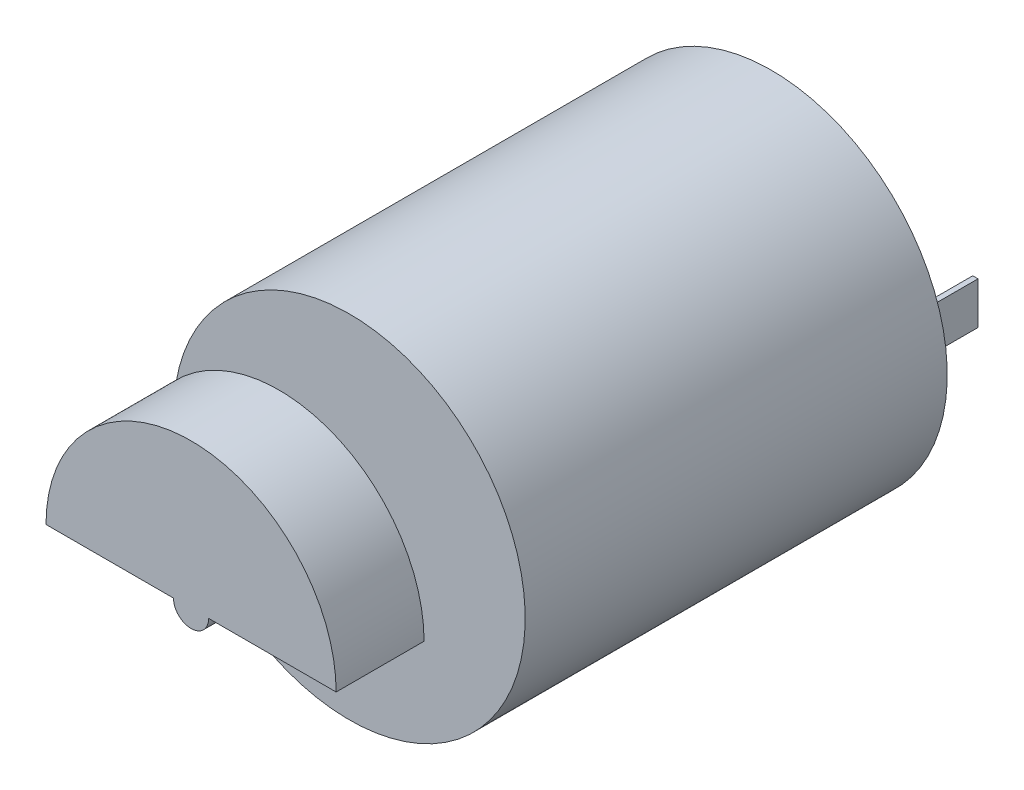
from build123d import *

# Parameters (mm, degrees)
SKETCH1_R           = 12.7
BOSS_EXTRUDE1_DEPTH = 15.24
SKETCH2_R           = 3.048
BOSS_EXTRUDE2_DEPTH = 1.27
SKETCH3_R           = 1.27
BOSS_EXTRUDE3_DEPTH = 10.16
BOSS_EXTRUDE4_DEPTH = 6.35
SKETCH5_R           = 4.191
BOSS_EXTRUDE5_DEPTH = 2.032
SKETCH6_W           = 0.381
SKETCH6_H           = 3.048
BOSS_EXTRUDE6_DEPTH = 5.588


with BuildPart() as part:
    # Sketch1 → Boss-Extrude1 (new, symmetric)
    with BuildSketch(Plane.XY):
        with Locations(Location((0, 0, 0), (0, 0, 180))):
            Circle(SKETCH1_R)
    extrude(amount=BOSS_EXTRUDE1_DEPTH, both=True)

    # Sketch2 → Boss-Extrude2 (add)
    with BuildSketch(Plane.XY.offset(15.24)):
        Circle(SKETCH2_R)
    extrude(amount=BOSS_EXTRUDE2_DEPTH)

    # Sketch3 → Boss-Extrude3 (add)
    with BuildSketch(Plane.XY.offset(16.51)):
        Circle(SKETCH3_R)
    extrude(amount=BOSS_EXTRUDE3_DEPTH)

    # Sketch4 → Boss-Extrude4 (add)
    with BuildSketch(Plane.XY.offset(26.67)):
        with BuildLine():
            Line((-10.4775, 0), (10.4775, 0))
            ThreePointArc((10.4775, 0), (0, 10.4775), (-10.4775, 0))
        make_face()
    extrude(amount=-BOSS_EXTRUDE4_DEPTH)

    # Sketch5 → Boss-Extrude5 (add)
    with BuildSketch(Plane(origin=(0, 0, -15.24), x_dir=(-1, 0, 0), z_dir=(0, 0, -1))):
        Circle(SKETCH5_R)
    extrude(amount=BOSS_EXTRUDE5_DEPTH)

    # Sketch6 → Boss-Extrude6 (add)
    with BuildSketch(Plane(origin=(0, 0, -15.24), x_dir=(-1, 0, 0), z_dir=(0, 0, -1))):
        with Locations((-9.144, 0)):
            Rectangle(SKETCH6_W, SKETCH6_H)
    boss_extrude6 = extrude(amount=BOSS_EXTRUDE6_DEPTH)

    # Mirror1: Boss-Extrude6 across plane
    add(boss_extrude6.mirror(Plane(origin=(0, 0, 0), x_dir=(0, 0, 1), z_dir=(1, 0, 0))))


solid = part.part
